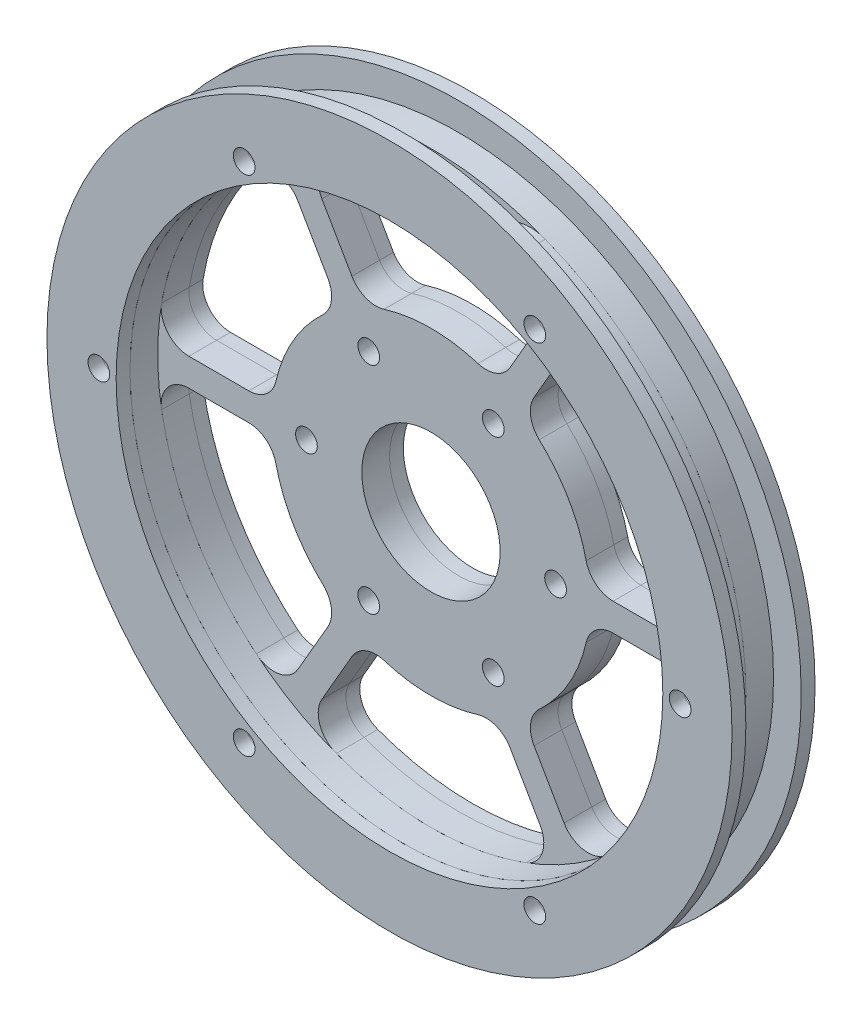
from build123d import *

# Parameters (mm, degrees)
SKETCH1_R           = 2.4892
BOSS_EXTRUDE1_DEPTH = 3.175
FILLET3_R           = 1.5875
SKETCH2_R           = 72.23125
SKETCH2_R_2         = 2.4892
SKETCH2_R_3         = 15.875
BOSS_EXTRUDE2_DEPTH = 6.35
SKETCH4_R           = 78.58125
SKETCH4_R_2         = 2.4892
SKETCH4_R_3         = 15.875
BOSS_EXTRUDE3_DEPTH = 3.175
SKETCH5_R           = 78.58125
SKETCH5_R_2         = 62.70625
SKETCH5_R_3         = 2.4892
BOSS_EXTRUDE4_DEPTH = 3.175
FILLET4_R           = 6.35
FILLET5_R           = 6.35


with BuildPart() as part:
    # Sketch1 → Boss-Extrude1 (new, symmetric)
    with BuildSketch(Plane.XY):
        with BuildLine():
            ThreePointArc((-62.62581867, -3.175), (-62.70625, 0), (-62.62581867, 3.175))
            ThreePointArc((-62.62581867, 3.175), (-54.305205476, 31.353125), (-34.062539992, 52.648049901))
            ThreePointArc((-34.062539992, 52.648049901), (-31.353125, 54.305205476), (-28.563278678, 55.823049901))
            ThreePointArc((-28.563278678, 55.823049901), (-21.28371557, 58.983703178), (-13.663241759, 61.199588346))
            ThreePointArc((-13.663241759, 61.199588346), (-18.617202125, 66.993781742), (-26.234383048, 67.298667317))
            ThreePointArc((-26.234383048, 67.298667317), (-40.75789001, -59.633445972), (72.23125, 0))
            ThreePointArc((72.23125, 0), (59.633445972, 40.75789001), (26.234383048, 67.298667317))
            ThreePointArc((26.234383048, 67.298667317), (18.617202125, 66.993781742), (13.663241759, 61.199588346))
            ThreePointArc((13.663241759, 61.199588346), (21.28371557, 58.983703178), (28.563278678, 55.823049901))
            ThreePointArc((28.563278678, 55.823049901), (31.353125, 54.305205476), (34.062539992, 52.648049901))
            ThreePointArc((34.062539992, 52.648049901), (54.305205476, 31.353125), (62.62581867, 3.175))
            ThreePointArc((62.62581867, 3.175), (62.70625, 0), (62.62581867, -3.175))
            ThreePointArc((62.62581867, -3.175), (54.305205476, -31.353125), (34.062539992, -52.648049901))
            ThreePointArc((34.062539992, -52.648049901), (31.353125, -54.305205476), (28.563278678, -55.823049901))
            ThreePointArc((28.563278678, -55.823049901), (0, -62.70625), (-28.563278678, -55.823049901))
            ThreePointArc((-28.563278678, -55.823049901), (-31.353125, -54.305205476), (-34.062539992, -52.648049901))
            ThreePointArc((-34.062539992, -52.648049901), (-54.305205476, -31.353125), (-62.62581867, -3.175))
        make_face()
        with Locations((-33.3375, -57.742243797)):
            Circle(SKETCH1_R, mode=Mode.SUBTRACT)
        with Locations((33.3375, -57.742243797)):
            Circle(SKETCH1_R, mode=Mode.SUBTRACT)
        with Locations((-66.675, 0)):
            Circle(SKETCH1_R, mode=Mode.SUBTRACT)
        with Locations((-33.3375, 57.742243797)):
            Circle(SKETCH1_R, mode=Mode.SUBTRACT)
        with Locations((66.675, 0)):
            Circle(SKETCH1_R, mode=Mode.SUBTRACT)
        with Locations((33.3375, 57.742243797)):
            Circle(SKETCH1_R, mode=Mode.SUBTRACT)
    extrude(amount=BOSS_EXTRUDE1_DEPTH, both=True)

    # Fillet3
    fillet3_edges = [part.edges().sort_by_distance(p)[0] for p in [
        (-13.663241759, 61.199588346, -1.5875),
        (13.663241759, 61.199588346, -1.5875),
    ]]
    fillet(fillet3_edges, radius=FILLET3_R)


with BuildPart() as body_2:
    # Sketch2 → Boss-Extrude2 (new body)
    with BuildSketch(Plane(origin=(0, 0, -3.175), x_dir=(-1, 0, 0), z_dir=(0, 0, -1))):
        Circle(SKETCH2_R)
        with BuildLine():
            ThreePointArc((15.437466632, 33.088476547), (0, 36.5125), (-15.437466632, 33.088476547))
            Line((-15.437466632, 33.088476547), (-28.563278678, 55.823049901))
            ThreePointArc((-28.563278678, 55.823049901), (0, 62.70625), (28.563278678, 55.823049901))
            Line((28.563278678, 55.823049901), (15.437466632, 33.088476547))
        make_face(mode=Mode.SUBTRACT)
        with BuildLine():
            ThreePointArc((36.374194579, 3.175), (31.620752556, 18.25625), (20.936727946, 29.913476547))
            Line((20.936727946, 29.913476547), (34.062539992, 52.648049901))
            ThreePointArc((34.062539992, 52.648049901), (54.305205476, 31.353125), (62.62581867, 3.175))
            Line((62.62581867, 3.175), (36.374194579, 3.175))
        make_face(mode=Mode.SUBTRACT)
        with BuildLine():
            ThreePointArc((-20.936727946, 29.913476547), (-31.620752556, 18.25625), (-36.374194579, 3.175))
            Line((-36.374194579, 3.175), (-62.62581867, 3.175))
            ThreePointArc((-62.62581867, 3.175), (-54.305205476, 31.353125), (-34.062539992, 52.648049901))
            Line((-34.062539992, 52.648049901), (-20.936727946, 29.913476547))
        make_face(mode=Mode.SUBTRACT)
        with BuildLine():
            ThreePointArc((-36.374194579, -3.175), (-31.620752556, -18.25625), (-20.936727946, -29.913476547))
            Line((-20.936727946, -29.913476547), (-34.062539992, -52.648049901))
            ThreePointArc((-34.062539992, -52.648049901), (-54.305205476, -31.353125), (-62.62581867, -3.175))
            Line((-62.62581867, -3.175), (-36.374194579, -3.175))
        make_face(mode=Mode.SUBTRACT)
        with BuildLine():
            Line((36.374194579, -3.175), (62.62581867, -3.175))
            ThreePointArc((62.62581867, -3.175), (54.305205476, -31.353125), (34.062539992, -52.648049901))
            Line((34.062539992, -52.648049901), (20.936727946, -29.913476547))
            ThreePointArc((20.936727946, -29.913476547), (31.620752556, -18.25625), (36.374194579, -3.175))
        make_face(mode=Mode.SUBTRACT)
        with BuildLine():
            ThreePointArc((-15.437466632, -33.088476547), (0, -36.5125), (15.437466632, -33.088476547))
            Line((15.437466632, -33.088476547), (28.563278678, -55.823049901))
            ThreePointArc((28.563278678, -55.823049901), (0, -62.70625), (-28.563278678, -55.823049901))
            Line((-28.563278678, -55.823049901), (-15.437466632, -33.088476547))
        make_face(mode=Mode.SUBTRACT)
        with Locations((-14.2875, -24.746675913)):
            Circle(SKETCH2_R_2, mode=Mode.SUBTRACT)
        with Locations((14.2875, -24.746675913)):
            Circle(SKETCH2_R_2, mode=Mode.SUBTRACT)
        with Locations((-28.575, 0)):
            Circle(SKETCH2_R_2, mode=Mode.SUBTRACT)
        Circle(SKETCH2_R_3, mode=Mode.SUBTRACT)
        with Locations((-14.2875, 24.746675913)):
            Circle(SKETCH2_R_2, mode=Mode.SUBTRACT)
        with Locations((28.575, 0)):
            Circle(SKETCH2_R_2, mode=Mode.SUBTRACT)
        with Locations((14.2875, 24.746675913)):
            Circle(SKETCH2_R_2, mode=Mode.SUBTRACT)
        with Locations((-33.3375, -57.742243797)):
            Circle(SKETCH2_R_2, mode=Mode.SUBTRACT)
        with Locations((33.3375, -57.742243797)):
            Circle(SKETCH2_R_2, mode=Mode.SUBTRACT)
        with Locations((-66.675, 0)):
            Circle(SKETCH2_R_2, mode=Mode.SUBTRACT)
        with Locations((-33.3375, 57.742243797)):
            Circle(SKETCH2_R_2, mode=Mode.SUBTRACT)
        with Locations((66.675, 0)):
            Circle(SKETCH2_R_2, mode=Mode.SUBTRACT)
        with Locations((33.3375, 57.742243797)):
            Circle(SKETCH2_R_2, mode=Mode.SUBTRACT)
    extrude(amount=BOSS_EXTRUDE2_DEPTH)

    # Fillet4
    fillet4_edges = [body_2.edges().sort_by_distance(p)[0] for p in [
        (15.437466632, 33.088476547, -6.35),
        (-15.437466632, 33.088476547, -6.35),
        (-28.563278678, 55.823049901, -6.35),
        (28.563278678, 55.823049901, -6.35),
        (-62.62581867, 3.175, -6.35),
        (-34.062539992, 52.648049901, -6.35),
        (-20.936727946, 29.913476547, -6.35),
        (-36.374194579, 3.175, -6.35),
        (-34.062539992, -52.648049901, -6.35),
        (-62.62581867, -3.175, -6.35),
        (-36.374194579, -3.175, -6.35),
        (-20.936727946, -29.913476547, -6.35),
        (28.563278678, -55.823049901, -6.35),
        (-28.563278678, -55.823049901, -6.35),
        (-15.437466632, -33.088476547, -6.35),
        (15.437466632, -33.088476547, -6.35),
        (62.62581867, -3.175, -6.35),
        (34.062539992, -52.648049901, -6.35),
        (20.936727946, -29.913476547, -6.35),
        (36.374194579, -3.175, -6.35),
        (34.062539992, 52.648049901, -6.35),
        (62.62581867, 3.175, -6.35),
        (36.374194579, 3.175, -6.35),
        (20.936727946, 29.913476547, -6.35),
    ]]
    fillet(fillet4_edges, radius=FILLET4_R)


with BuildPart() as body_3:
    # Sketch4 → Boss-Extrude3 (new body)
    with BuildSketch(Plane(origin=(0, 0, -9.525), x_dir=(-1, 0, 0), z_dir=(0, 0, -1))):
        Circle(SKETCH4_R)
        with Locations((-33.3375, -57.742243797)):
            Circle(SKETCH4_R_2, mode=Mode.SUBTRACT)
        with BuildLine():
            Line((-62.62581867, -3.175), (-36.374194579, -3.175))
            ThreePointArc((-36.374194579, -3.175), (-31.620752556, -18.25625), (-20.936727946, -29.913476547))
            Line((-20.936727946, -29.913476547), (-34.062539992, -52.648049901))
            ThreePointArc((-34.062539992, -52.648049901), (-54.305205476, -31.353125), (-62.62581867, -3.175))
        make_face(mode=Mode.SUBTRACT)
        with Locations((-14.2875, -24.746675913)):
            Circle(SKETCH4_R_2, mode=Mode.SUBTRACT)
        with BuildLine():
            Line((-28.563278678, -55.823049901), (-15.437466632, -33.088476547))
            ThreePointArc((-15.437466632, -33.088476547), (0, -36.5125), (15.437466632, -33.088476547))
            Line((15.437466632, -33.088476547), (28.563278678, -55.823049901))
            ThreePointArc((28.563278678, -55.823049901), (0, -62.70625), (-28.563278678, -55.823049901))
        make_face(mode=Mode.SUBTRACT)
        with Locations((33.3375, -57.742243797)):
            Circle(SKETCH4_R_2, mode=Mode.SUBTRACT)
        with Locations((14.2875, -24.746675913)):
            Circle(SKETCH4_R_2, mode=Mode.SUBTRACT)
        with BuildLine():
            Line((36.374194579, -3.175), (62.62581867, -3.175))
            ThreePointArc((62.62581867, -3.175), (54.305205476, -31.353125), (34.062539992, -52.648049901))
            Line((34.062539992, -52.648049901), (20.936727946, -29.913476547))
            ThreePointArc((20.936727946, -29.913476547), (31.620752556, -18.25625), (36.374194579, -3.175))
        make_face(mode=Mode.SUBTRACT)
        with Locations((66.675, 0)):
            Circle(SKETCH4_R_2, mode=Mode.SUBTRACT)
        with Locations((-66.675, 0)):
            Circle(SKETCH4_R_2, mode=Mode.SUBTRACT)
        with BuildLine():
            Line((-34.062539992, 52.648049901), (-20.936727946, 29.913476547))
            ThreePointArc((-20.936727946, 29.913476547), (-31.620752556, 18.25625), (-36.374194579, 3.175))
            Line((-36.374194579, 3.175), (-62.62581867, 3.175))
            ThreePointArc((-62.62581867, 3.175), (-54.305205476, 31.353125), (-34.062539992, 52.648049901))
        make_face(mode=Mode.SUBTRACT)
        with Locations((-28.575, 0)):
            Circle(SKETCH4_R_2, mode=Mode.SUBTRACT)
        with Locations((-14.2875, 24.746675913)):
            Circle(SKETCH4_R_2, mode=Mode.SUBTRACT)
        with Locations((-33.3375, 57.742243797)):
            Circle(SKETCH4_R_2, mode=Mode.SUBTRACT)
        Circle(SKETCH4_R_3, mode=Mode.SUBTRACT)
        with Locations((28.575, 0)):
            Circle(SKETCH4_R_2, mode=Mode.SUBTRACT)
        with Locations((14.2875, 24.746675913)):
            Circle(SKETCH4_R_2, mode=Mode.SUBTRACT)
        with BuildLine():
            Line((20.936727946, 29.913476547), (34.062539992, 52.648049901))
            ThreePointArc((34.062539992, 52.648049901), (54.305205476, 31.353125), (62.62581867, 3.175))
            Line((62.62581867, 3.175), (36.374194579, 3.175))
            ThreePointArc((36.374194579, 3.175), (31.620752556, 18.25625), (20.936727946, 29.913476547))
        make_face(mode=Mode.SUBTRACT)
        with BuildLine():
            Line((-15.437466632, 33.088476547), (-28.563278678, 55.823049901))
            ThreePointArc((-28.563278678, 55.823049901), (0, 62.70625), (28.563278678, 55.823049901))
            Line((28.563278678, 55.823049901), (15.437466632, 33.088476547))
            ThreePointArc((15.437466632, 33.088476547), (0, 36.5125), (-15.437466632, 33.088476547))
        make_face(mode=Mode.SUBTRACT)
        with Locations((33.3375, 57.742243797)):
            Circle(SKETCH4_R_2, mode=Mode.SUBTRACT)
    extrude(amount=BOSS_EXTRUDE3_DEPTH)

    # Fillet5
    fillet5_edges = [body_3.edges().sort_by_distance(p)[0] for p in [
        (-36.374194579, 3.175, -11.1125),
        (-62.62581867, 3.175, -11.1125),
        (-34.062539992, 52.648049901, -11.1125),
        (-20.936727946, 29.913476547, -11.1125),
        (28.563278678, 55.823049901, -11.1125),
        (15.437466632, 33.088476547, -11.1125),
        (-15.437466632, 33.088476547, -11.1125),
        (-28.563278678, 55.823049901, -11.1125),
        (62.62581867, 3.175, -11.1125),
        (36.374194579, 3.175, -11.1125),
        (20.936727946, 29.913476547, -11.1125),
        (34.062539992, 52.648049901, -11.1125),
        (34.062539992, -52.648049901, -11.1125),
        (20.936727946, -29.913476547, -11.1125),
        (36.374194579, -3.175, -11.1125),
        (62.62581867, -3.175, -11.1125),
        (-28.563278678, -55.823049901, -11.1125),
        (-15.437466632, -33.088476547, -11.1125),
        (15.437466632, -33.088476547, -11.1125),
        (28.563278678, -55.823049901, -11.1125),
        (-62.62581867, -3.175, -11.1125),
        (-36.374194579, -3.175, -11.1125),
        (-20.936727946, -29.913476547, -11.1125),
        (-34.062539992, -52.648049901, -11.1125),
    ]]
    fillet(fillet5_edges, radius=FILLET5_R)


with BuildPart() as body_4:
    # Sketch5 → Boss-Extrude4 (new body)
    with BuildSketch(Plane(origin=(0, 0, 3.175), x_dir=(1, 0, 0), z_dir=(0, 0, -1))):
        Circle(SKETCH5_R)
        Circle(SKETCH5_R_2, mode=Mode.SUBTRACT)
        with Locations((33.3375, 57.742243797)):
            Circle(SKETCH5_R_3, mode=Mode.SUBTRACT)
        with Locations((-33.3375, 57.742243797)):
            Circle(SKETCH5_R_3, mode=Mode.SUBTRACT)
        with Locations((-66.675, 0)):
            Circle(SKETCH5_R_3, mode=Mode.SUBTRACT)
        with Locations((-33.3375, -57.742243797)):
            Circle(SKETCH5_R_3, mode=Mode.SUBTRACT)
        with Locations((33.3375, -57.742243797)):
            Circle(SKETCH5_R_3, mode=Mode.SUBTRACT)
        with Locations((66.675, 0)):
            Circle(SKETCH5_R_3, mode=Mode.SUBTRACT)
    extrude(amount=-BOSS_EXTRUDE4_DEPTH)


solid = Compound([part.part, body_2.part, body_3.part, body_4.part])
